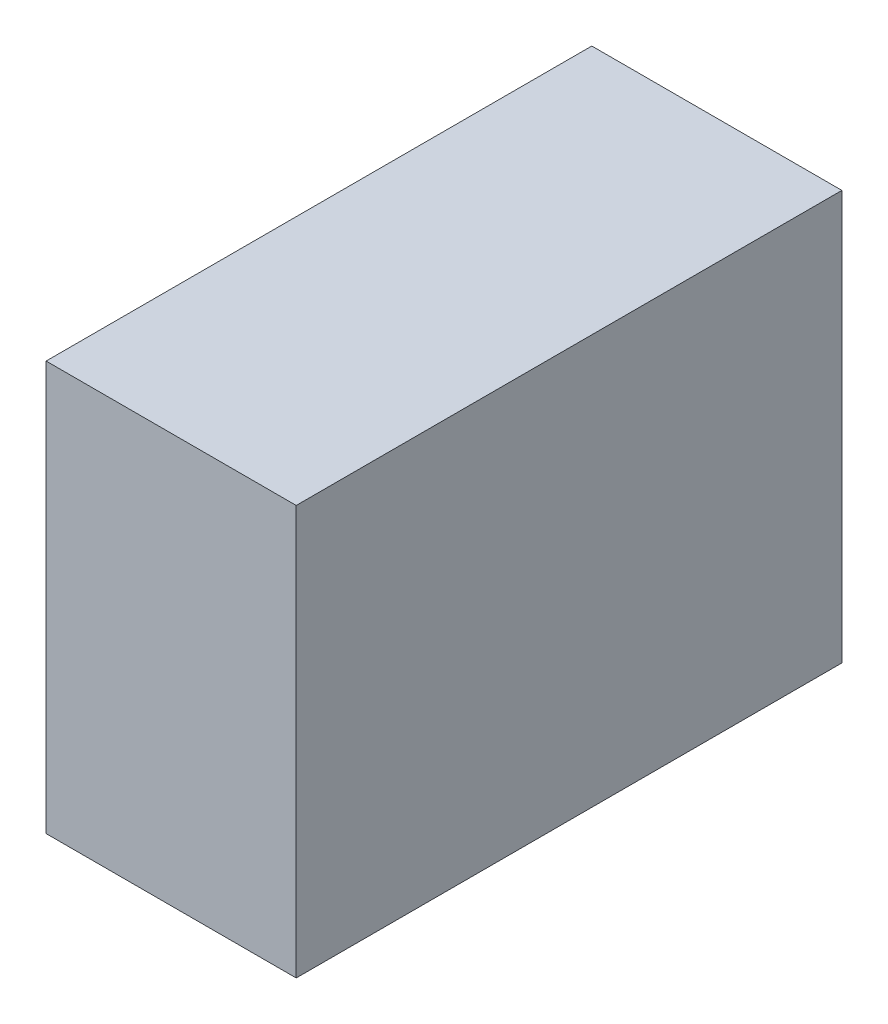
from build123d import *

# Parameters (mm, degrees)
SKETCH1_W           = 5.5
SKETCH1_H           = 9
BOSS_EXTRUDE1_DEPTH = 12


with BuildPart() as part:
    # Sketch1 → Boss-Extrude1 (new body)
    with BuildSketch(Plane.XY):
        with Locations((29.4962, 89.226)):
            Rectangle(SKETCH1_W, SKETCH1_H)
    extrude(amount=BOSS_EXTRUDE1_DEPTH)


solid = part.part
